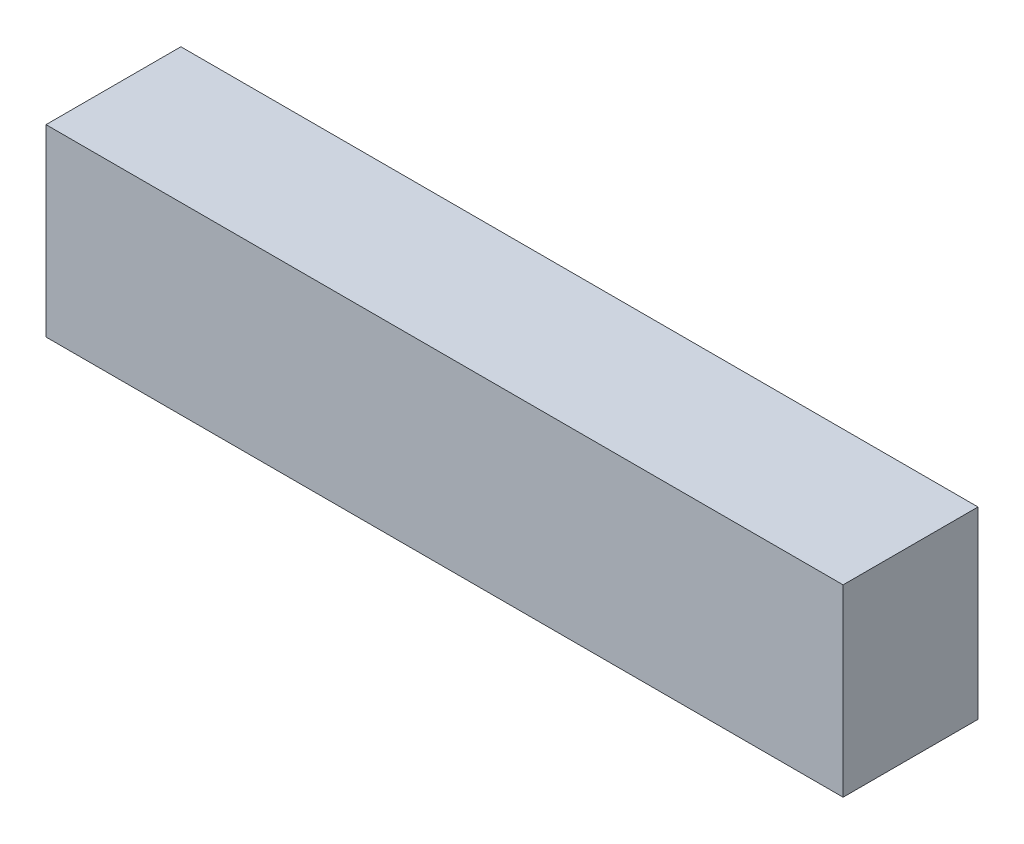
from build123d import *

# Parameters (mm, degrees)
SKETCH1_W           = 130
SKETCH1_H           = 22
BOSS_EXTRUDE1_DEPTH = 30


with BuildPart() as part:
    # Sketch1 → Boss-Extrude1 (new body)
    with BuildSketch(Plane(origin=(0, 0, 0), x_dir=(1, 0, 0), z_dir=(0, 1, 0))):
        with Locations((65, 11)):
            Rectangle(SKETCH1_W, SKETCH1_H)
    extrude(amount=BOSS_EXTRUDE1_DEPTH)


solid = part.part
